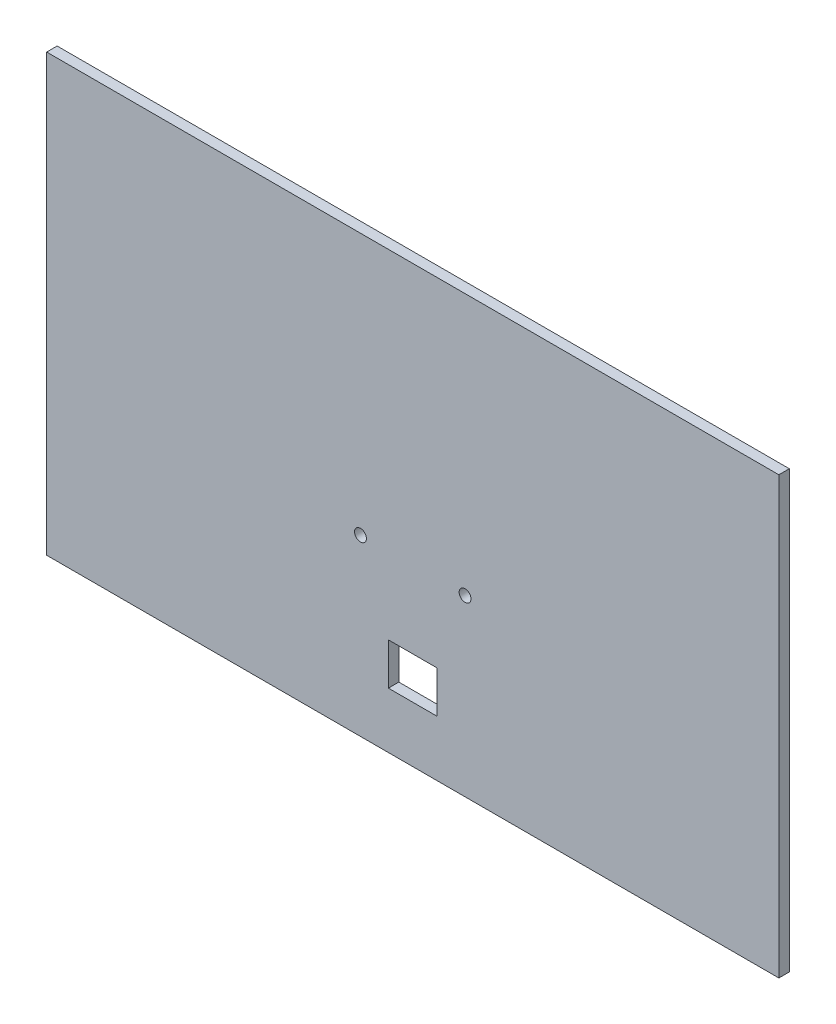
from build123d import *

# Parameters (mm, degrees)
SK_PLATE_W            = 210
SK_PLATE_H            = 125
EX_PLATE_DEPTH        = 3
SK_WEDGESCREWS_R      = 1.7
CUT_WEDGESCREWS_DEPTH = 3
SK_USB_SLOT_W         = 14
SK_USB_SLOT_H         = 12
CUT_USB_SLOT_DEPTH    = 3


with BuildPart() as part:
    # SK_Plate → EX_Plate (new body)
    with BuildSketch(Plane.XY):
        with Locations((0, 62.5)):
            Rectangle(SK_PLATE_W, SK_PLATE_H)
    extrude(amount=EX_PLATE_DEPTH)

    # SK_WedgeScrews → CUT_WedgeScrews (cut)
    with BuildSketch(Plane.XY):
        with Locations((15, 50)):
            Circle(SK_WEDGESCREWS_R)
        with Locations((-15, 50)):
            Circle(SK_WEDGESCREWS_R)
    extrude(amount=CUT_WEDGESCREWS_DEPTH, mode=Mode.SUBTRACT)

    # SK_USB_Slot → CUT_USB_Slot (cut)
    with BuildSketch(Plane.XY):
        with Locations((0, 22)):
            Rectangle(SK_USB_SLOT_W, SK_USB_SLOT_H)
    extrude(amount=CUT_USB_SLOT_DEPTH, mode=Mode.SUBTRACT)


solid = part.part
